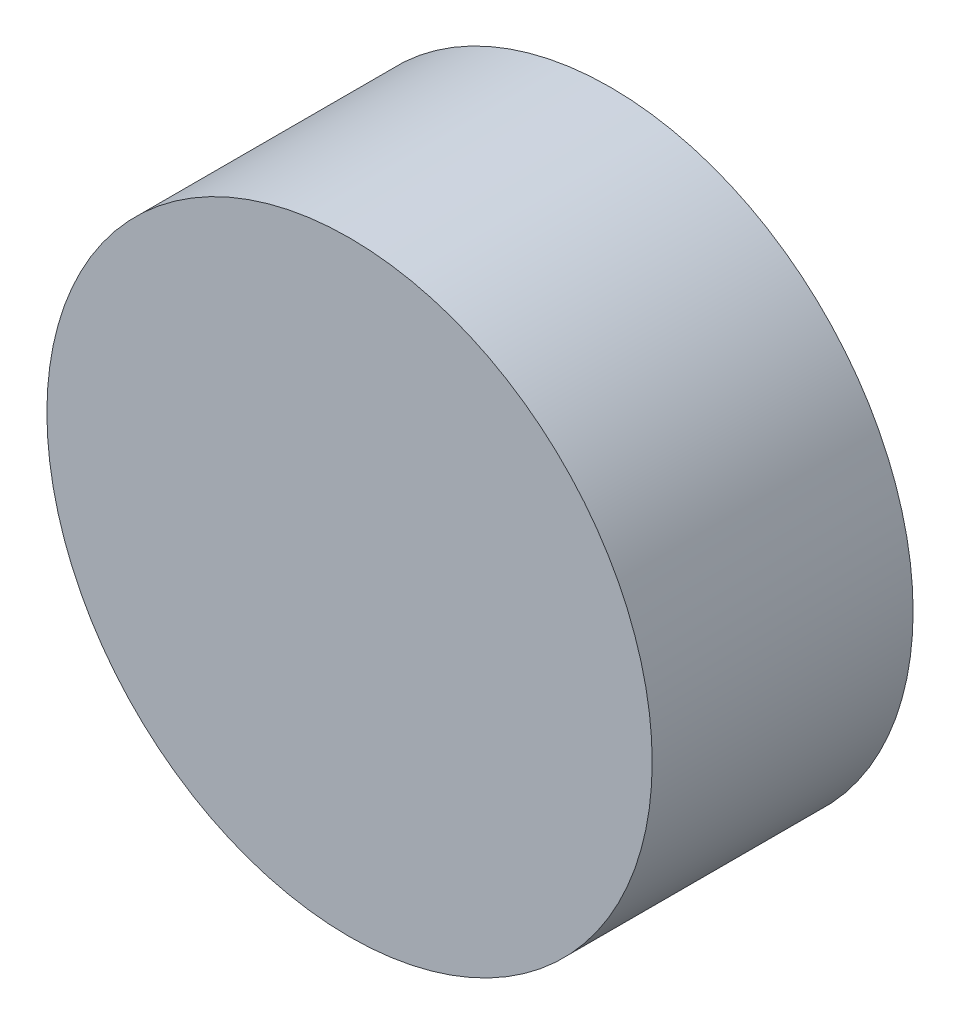
from build123d import *

# Parameters (mm, degrees)
SKETCH1_R           = 29
BOSS_EXTRUDE2_DEPTH = 25


with BuildPart() as part:
    # Sketch1 → Boss-Extrude2 (new body)
    with BuildSketch(Plane.XY):
        Circle(SKETCH1_R)
    extrude(amount=BOSS_EXTRUDE2_DEPTH)


solid = part.part
